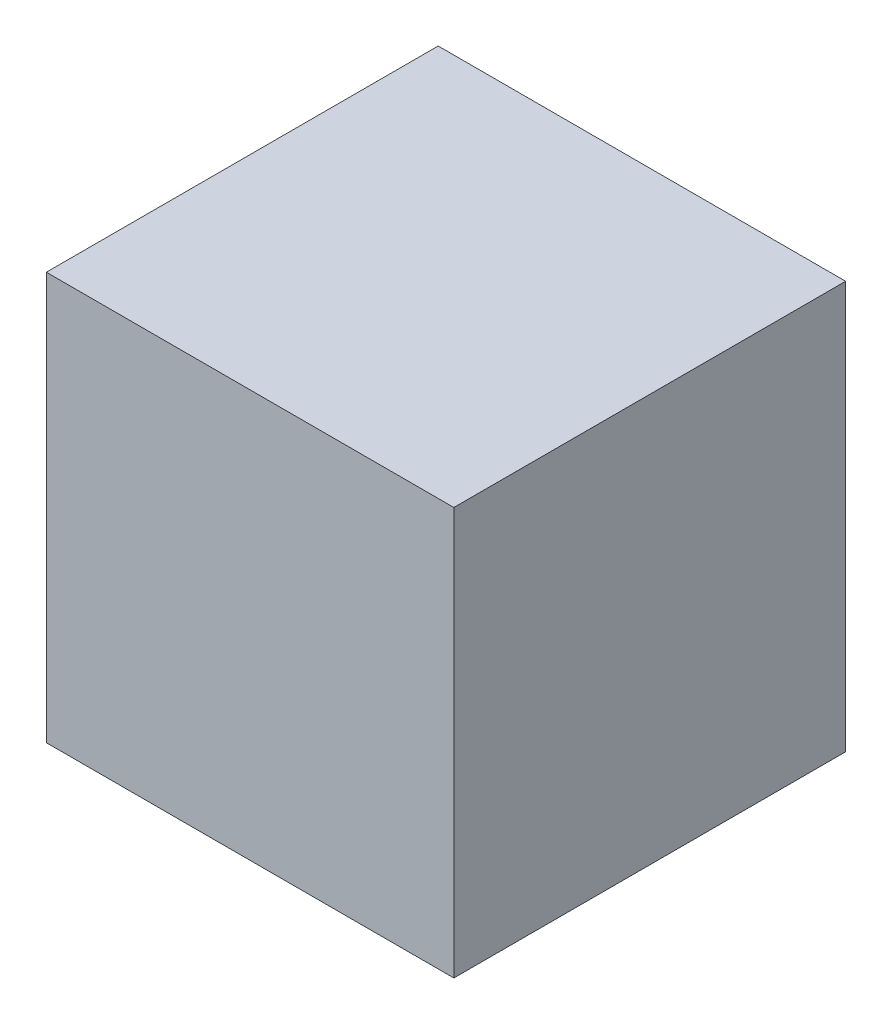
from build123d import *

# Parameters (mm, degrees)
SKETCH1_W           = 6.604
SKETCH1_H           = 6.604
BOSS_EXTRUDE1_DEPTH = 6.35
SKETCH2_R           = 0.8255
BOSS_EXTRUDE2_DEPTH = 1.27


with BuildPart() as part:
    # Sketch1 → Boss-Extrude1 (new body)
    with BuildSketch(Plane.XY):
        Rectangle(SKETCH1_W, SKETCH1_H)
    extrude(amount=BOSS_EXTRUDE1_DEPTH)

    # Sketch2 → Boss-Extrude2 (add)
    with BuildSketch(Plane(origin=(0, 0, 0), x_dir=(-1, 0, 0), z_dir=(0, 0, -1))):
        Circle(SKETCH2_R)
    extrude(amount=BOSS_EXTRUDE2_DEPTH)


solid = part.part
